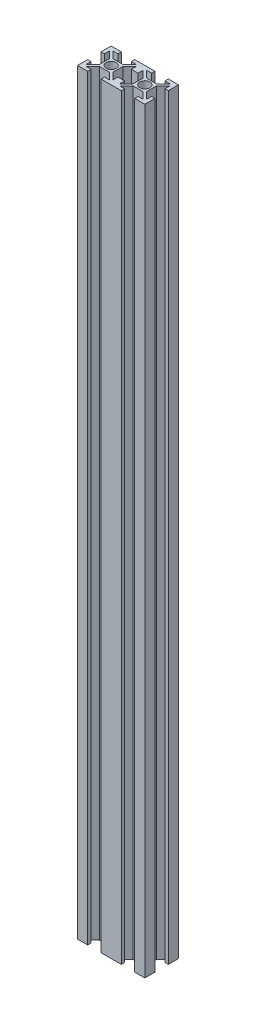
from build123d import *

# Parameters (mm, degrees)
F_2020_SKETCH_R     = 3
BOSS_EXTRUDE1_DEPTH = 450


with BuildPart() as part:
    # 2020 sketch → Boss-Extrude1 (new body)
    with BuildSketch(Plane(origin=(0, 0, 0), x_dir=(1, 0, 0), z_dir=(0, 1, 0))):
        Polygon((-4, 10), (-4, 8), (-7, 8), (-3, 4), (3, 4), (7, 8), (4, 8), (4, 10), (10, 10), (10, 4), (8, 4), (8, 7), (4, 3), (4, -3), (8, -7), (8, -4), (10, -4), (10, -10), (4, -10), (4, -8), (7, -8), (3, -4), (-3, -4), (-7, -8), (-4, -8), (-4, -10), (-10, -10), (-10, -4), (-8, -4), (-8, -7), (-4, -3), (-4, 3), (-8, 7), (-8, 4), (-10, 4), (-10, 10), align=None)
        with Locations(Location((0, 0, 0), (0, 0, 270))):
            Circle(F_2020_SKETCH_R, mode=Mode.SUBTRACT)
    boss_extrude1 = extrude(amount=BOSS_EXTRUDE1_DEPTH)

    # Mirror1: Boss-Extrude1 across plane
    add(boss_extrude1.mirror(Plane(origin=(10, 450, 4), x_dir=(0, 0, 1), z_dir=(1, 0, 0))))


solid = part.part
